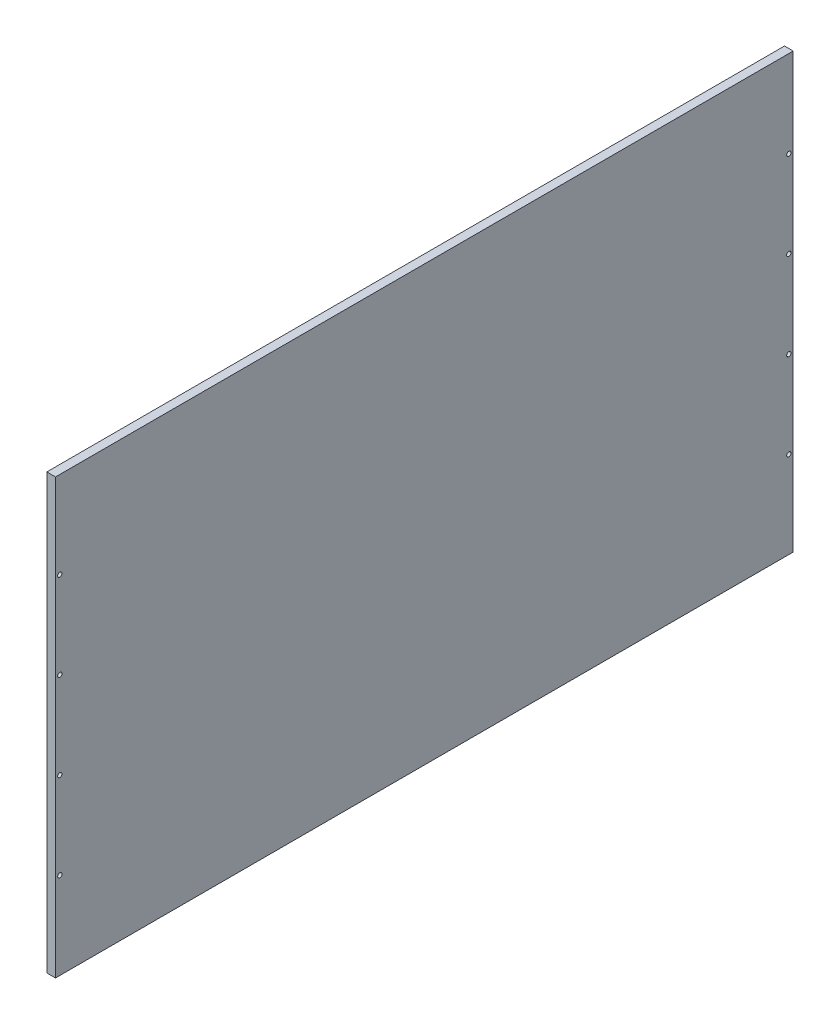
from build123d import *

# Parameters (mm, degrees)
CROQUIS1_W              = 850
CROQUIS1_H              = 500
SALIENTE_EXTRUIR1_DEPTH = 5
CROQUIS3_R              = 2.5
CORTAR_EXTRUIR1_DEPTH   = 5
CROQUIS5_R              = 2.5
CORTAR_EXTRUIR3_DEPTH   = 5


with BuildPart() as part:
    # Croquis1 → Saliente-Extruir1 (new, symmetric)
    with BuildSketch(Plane(origin=(0, 0, 0), x_dir=(0, 0, -1), z_dir=(1, 0, 0))):
        Rectangle(CROQUIS1_W, CROQUIS1_H)
    extrude(amount=SALIENTE_EXTRUIR1_DEPTH, both=True)

    # Croquis3 → Cortar-Extruir1 (cut)
    with BuildSketch(Plane.XZ.offset(250)):
        with Locations(Location((0, -375, 0), (0, 0, 270))):
            Circle(CROQUIS3_R)
        with Locations(Location((0, -275, 0), (0, 0, 270))):
            Circle(CROQUIS3_R)
        with Locations(Location((0, -175, 0), (0, 0, 270))):
            Circle(CROQUIS3_R)
        with Locations(Location((0, -75, 0), (0, 0, 270))):
            Circle(CROQUIS3_R)
        with Locations(Location((0, 25, 0), (0, 0, 270))):
            Circle(CROQUIS3_R)
        with Locations(Location((0, 125, 0), (0, 0, 270))):
            Circle(CROQUIS3_R)
        with Locations(Location((0, 225, 0), (0, 0, 270))):
            Circle(CROQUIS3_R)
        with Locations(Location((0, 325, 0), (0, 0, 270))):
            Circle(CROQUIS3_R)
    extrude(amount=-CORTAR_EXTRUIR1_DEPTH, mode=Mode.SUBTRACT)

    # Croquis5 → Cortar-Extruir3 (cut)
    with BuildSketch(Plane(origin=(5, 0, 0), x_dir=(0, 0, -1), z_dir=(1, 0, 0))):
        with Locations((-420, -150)):
            Circle(CROQUIS5_R)
        with Locations((-420, -50)):
            Circle(CROQUIS5_R)
        with Locations((-420, 50)):
            Circle(CROQUIS5_R)
        with Locations((-420, 150)):
            Circle(CROQUIS5_R)
        with Locations(Location((420, 150, 0), (0, 0, 180))):
            Circle(CROQUIS5_R)
        with Locations(Location((420, 50, 0), (0, 0, 180))):
            Circle(CROQUIS5_R)
        with Locations(Location((420, -50, 0), (0, 0, 180))):
            Circle(CROQUIS5_R)
        with Locations(Location((420, -150, 0), (0, 0, 180))):
            Circle(CROQUIS5_R)
    extrude(amount=-CORTAR_EXTRUIR3_DEPTH, mode=Mode.SUBTRACT)


solid = part.part
